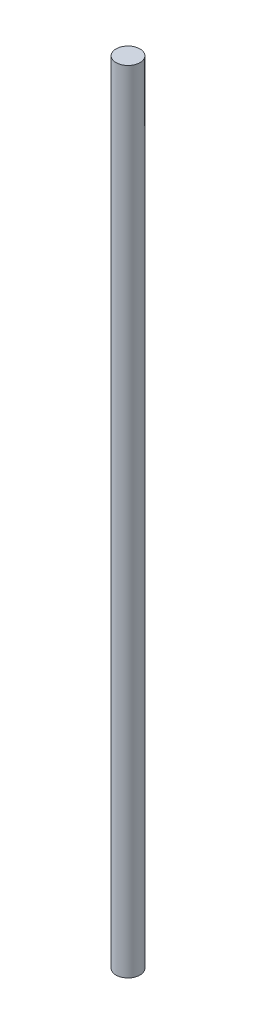
from build123d import *

# Parameters (mm, degrees)
SKETCH1_R           = 5
BOSS_EXTRUDE1_DEPTH = 331


with BuildPart() as part:
    # Sketch1 → Boss-Extrude1 (new body)
    with BuildSketch(Plane(origin=(0, 0, 0), x_dir=(1, 0, 0), z_dir=(0, 1, 0))):
        with Locations(Location((0, 0, 0), (0, 0, 270))):
            Circle(SKETCH1_R)
    extrude(amount=BOSS_EXTRUDE1_DEPTH)


solid = part.part
